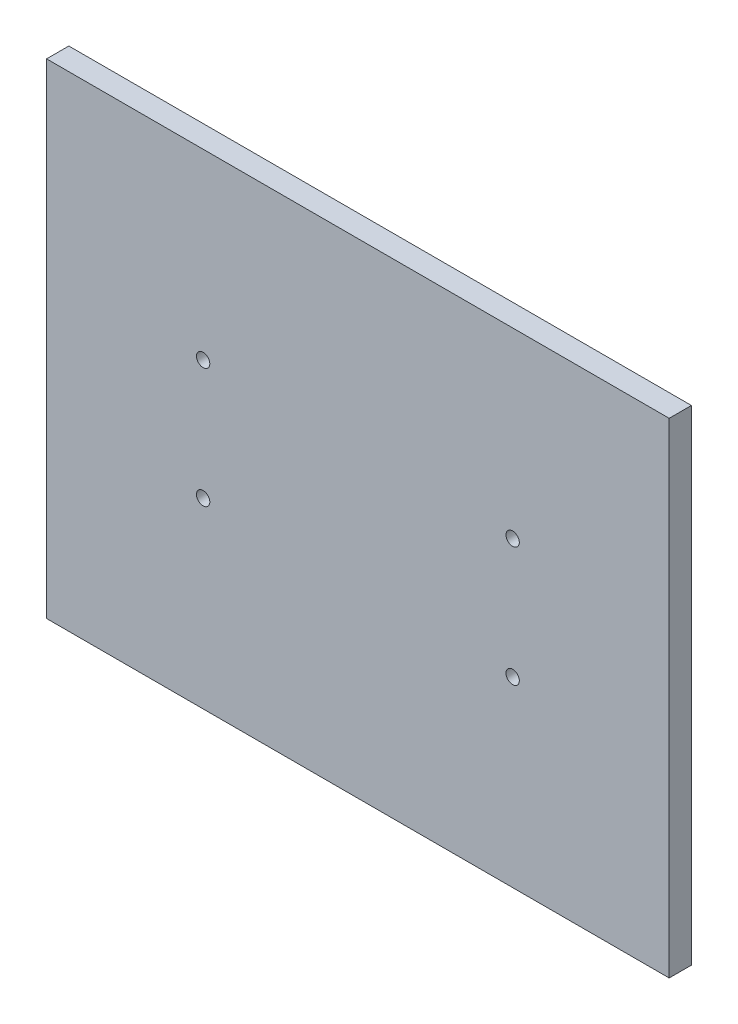
from build123d import *

# Parameters (mm, degrees)
SKETCH1_W           = 140
SKETCH1_H           = 109
BOSS_EXTRUDE1_DEPTH = 5
SKETCH2_R           = 1.5
CUT_EXTRUDE1_DEPTH  = 5


with BuildPart() as part:
    # Sketch1 → Boss-Extrude1 (new body)
    with BuildSketch(Plane.XY):
        Rectangle(SKETCH1_W, SKETCH1_H)
    extrude(amount=BOSS_EXTRUDE1_DEPTH)

    # Sketch2 → Cut-Extrude1 (cut)
    with BuildSketch(Plane.XY.offset(5)):
        with Locations((-34.8, 13.46)):
            Circle(SKETCH2_R)
        with Locations((34.8, 13.46)):
            Circle(SKETCH2_R)
        with Locations((34.8, -13.46)):
            Circle(SKETCH2_R)
        with Locations((-34.8, -13.46)):
            Circle(SKETCH2_R)
    extrude(amount=-CUT_EXTRUDE1_DEPTH, mode=Mode.SUBTRACT)


solid = part.part
